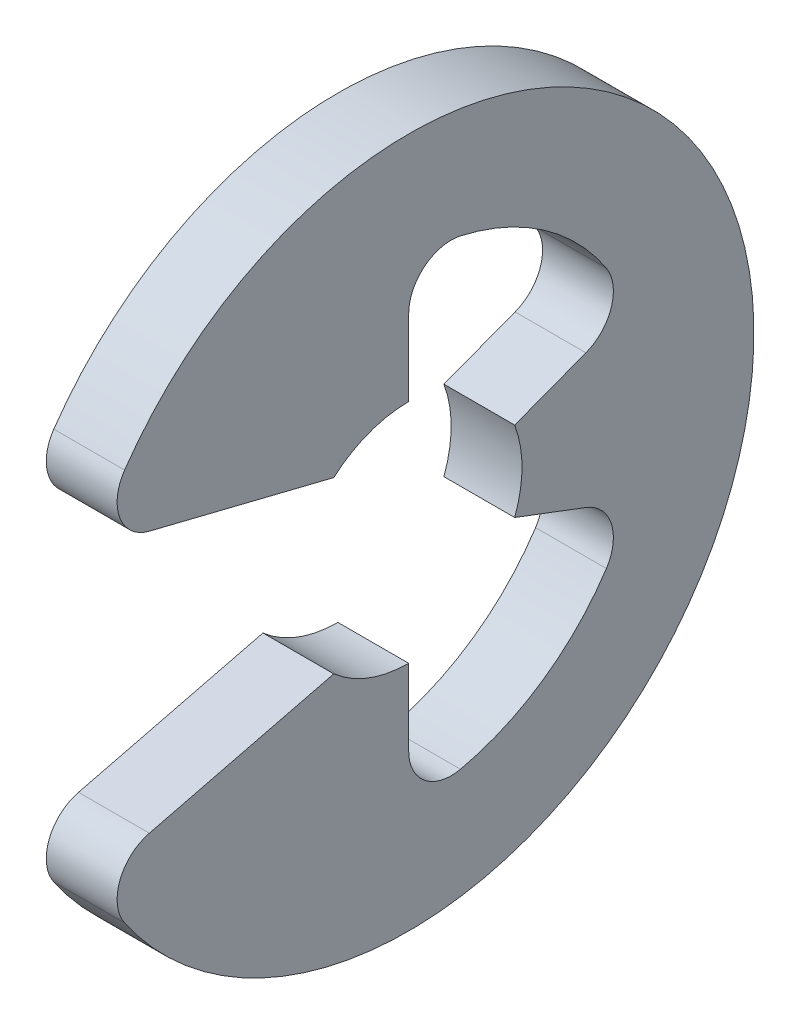
from build123d import *

# Parameters (mm, degrees)
EXTRUDE1_DEPTH = 0.2
FILLET1_R      = 0.24


with BuildPart() as part:
    # Sketch1 → Extrude1 (new, symmetric)
    with BuildSketch(Plane(origin=(0, 0, 0), x_dir=(0, 0, -1), z_dir=(1, 0, 0))):
        with BuildLine():
            Line((-1.771635896, -0.814743059), (-0.42332021, -0.48))
            ThreePointArc((-0.42332021, -0.48), (-0.22627417, -0.598665182), (0, -0.64))
            Line((0, -0.64), (0, -1.336774194))
            ThreePointArc((0, -1.336774194), (0.759992639, -1.099716524), (1.250437759, -0.472621049))
            Line((1.250437759, -0.472621049), (0.598665182, -0.22627417))
            ThreePointArc((0.598665182, -0.22627417), (0.64, 0), (0.598665182, 0.22627417))
            Line((0.598665182, 0.22627417), (1.250437759, 0.472621049))
            ThreePointArc((1.250437759, 0.472621049), (0.759992639, 1.099716524), (0, 1.336774194))
            Line((0, 1.336774194), (0, 0.64))
            ThreePointArc((0, 0.64), (-0.22627417, 0.598665182), (-0.42332021, 0.48))
            Line((-0.42332021, 0.48), (-1.771635896, 0.814743059))
            ThreePointArc((-1.771635896, 0.814743059), (1.95, 0), (-1.771635896, -0.814743059))
        make_face()
    extrude(amount=EXTRUDE1_DEPTH, both=True)

    # Fillet1
    fillet1_edges = [part.edges().sort_by_distance(p)[0] for p in [
        (0, -0.814743059, 1.771635896),
        (0, -1.336774194, 0),
        (0, -0.472621049, -1.250437759),
        (0, 0.472621049, -1.250437759),
        (0, 1.336774194, 0),
        (0, 0.814743059, 1.771635896),
    ]]
    fillet(fillet1_edges, radius=FILLET1_R)


solid = part.part
